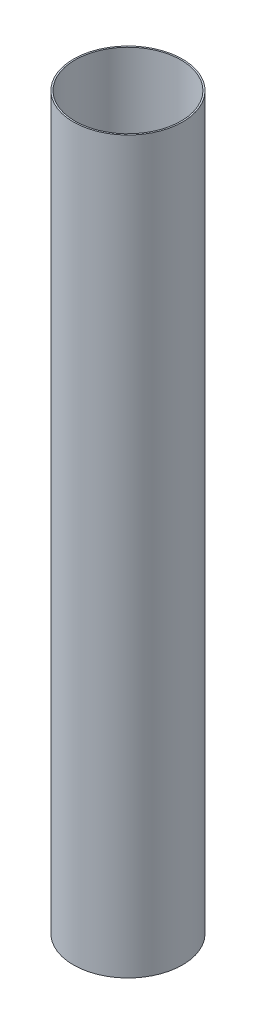
from build123d import *

# Parameters (mm, degrees)
SKETCH1_R           = 7.8359
SKETCH1_R_2         = 7.62
BOSS_EXTRUDE1_DEPTH = 104.902


with BuildPart() as part:
    # Sketch1 → Boss-Extrude1 (new body)
    with BuildSketch(Plane(origin=(0, 0, 0), x_dir=(1, 0, 0), z_dir=(0, 1, 0))):
        with Locations(Location((0, 0, 0), (0, 0, 270))):
            Circle(SKETCH1_R)
        with Locations(Location((0, 0, 0), (0, 0, 270))):
            Circle(SKETCH1_R_2, mode=Mode.SUBTRACT)
    extrude(amount=BOSS_EXTRUDE1_DEPTH)


solid = part.part
